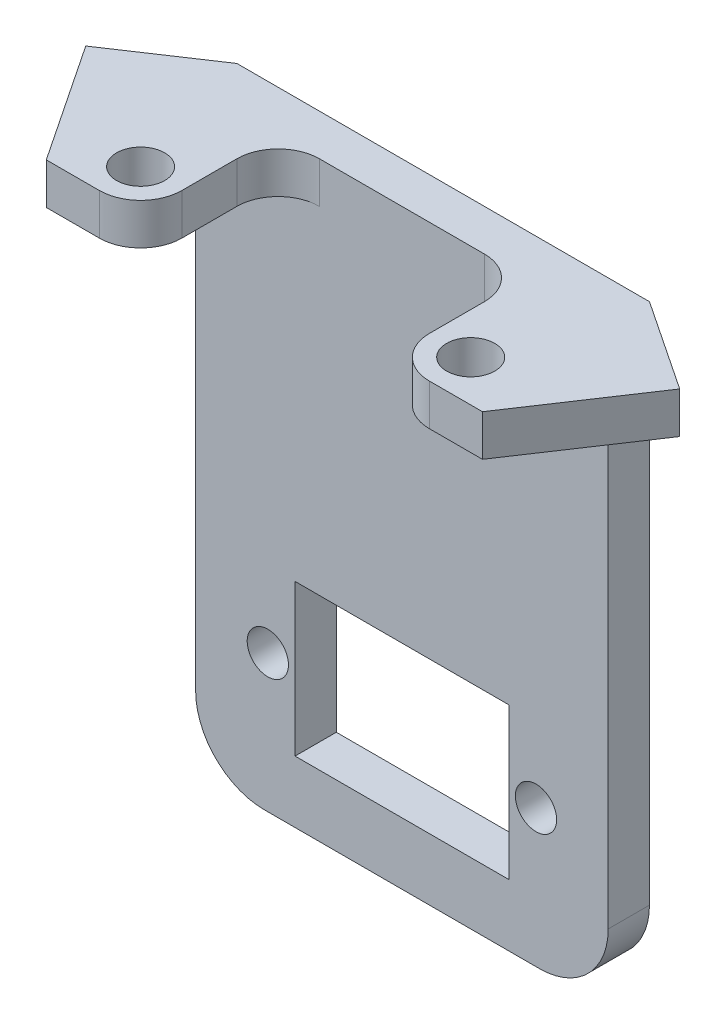
from build123d import *
from build123d.topology import SkipClean

# Parameters (mm, degrees)
SKETCH1_W           = 25
SKETCH1_H           = 20
SKETCH1_R           = 1.5
BOSS_EXTRUDE1_DEPTH = 3
SKETCH2_W           = 15.54
SKETCH2_H           = 11
CUT_EXTRUDE1_DEPTH  = 17.286497475
SKETCH4_W           = 25
SKETCH4_H           = 3
BOSS_EXTRUDE2_DEPTH = 3
SKETCH5_W           = 25
SKETCH5_H           = 3
BOSS_EXTRUDE3_DEPTH = 10
SKETCH11_W          = 25
SKETCH11_H          = 13
BOSS_EXTRUDE5_DEPTH = 20
SKETCH12_W          = 25
SKETCH12_H          = 10
CUT_EXTRUDE4_DEPTH  = 20
BOSS_EXTRUDE6_DEPTH = 2.5
BOSS_EXTRUDE7_DEPTH = 2.5
SKETCH16_R          = 1.75
CUT_EXTRUDE5_DEPTH  = 45.654227124
FILLET6_R           = 3
FILLET7_R           = 3
CUT_EXTRUDE6_DEPTH  = 45.654227124
FILLET8_R           = 5
BOSS_EXTRUDE8_DEPTH = 3


with BuildPart() as part:
    # Sketch1 → Boss-Extrude1 (new body)
    with BuildSketch(Plane.XY):
        Rectangle(SKETCH1_W, SKETCH1_H)
        with Locations((-9.75, 0)):
            Circle(SKETCH1_R, mode=Mode.SUBTRACT)
        with Locations((9.75, 0)):
            Circle(SKETCH1_R, mode=Mode.SUBTRACT)
    extrude(amount=BOSS_EXTRUDE1_DEPTH)

    # Sketch2 → Cut-Extrude1 (cut, through all)
    with BuildSketch(Plane.XY.offset(3)):
        Rectangle(SKETCH2_W, SKETCH2_H)
    extrude(amount=-CUT_EXTRUDE1_DEPTH, mode=Mode.SUBTRACT)

    # Sketch4 → Boss-Extrude2 (add)
    with BuildSketch(Plane(origin=(0, 10, 0), x_dir=(1, 0, 0), z_dir=(0, 1, 0))):
        with Locations((0, -1.5)):
            Rectangle(SKETCH4_W, SKETCH4_H)
    extrude(amount=BOSS_EXTRUDE2_DEPTH)

    # Sketch5 → Boss-Extrude3 (add)
    with BuildSketch(Plane.XY.offset(3)):
        with Locations((0, 11.5)):
            Rectangle(SKETCH5_W, SKETCH5_H)
    extrude(amount=BOSS_EXTRUDE3_DEPTH)

    # Sketch11 → Boss-Extrude5 (add)
    with BuildSketch(Plane(origin=(0, 13, 0), x_dir=(1, 0, 0), z_dir=(0, 1, 0))):
        with Locations((0, -6.5)):
            Rectangle(SKETCH11_W, SKETCH11_H)
    extrude(amount=BOSS_EXTRUDE5_DEPTH)

    # Sketch12 → Cut-Extrude4 (cut)
    with BuildSketch(Plane.XZ.offset(-10)):
        with Locations((0, 8)):
            Rectangle(SKETCH12_W, SKETCH12_H)
    extrude(amount=-CUT_EXTRUDE4_DEPTH, mode=Mode.SUBTRACT)

    # Sketch13 → Boss-Extrude6 (add)
    with BuildSketch(Plane.ZY.offset(12.5)):
        Polygon((3, -10), (3, 30), (13, 30), (13, 33), (0, 33), (0, -10), align=None)
    extrude(amount=BOSS_EXTRUDE6_DEPTH)

    # Sketch14 → Boss-Extrude7 (add)
    with BuildSketch(Plane(origin=(12.5, 0, 0), x_dir=(0, 0, -1), z_dir=(1, 0, 0))):
        Polygon((-13, 30), (-3, 30), (-3, -10), (0, -10), (0, 33), (-13, 33), align=None)
    extrude(amount=BOSS_EXTRUDE7_DEPTH)

    # Sketch16 → Cut-Extrude5 (cut, through all)
    with BuildSketch(Plane.XZ.offset(-30)):
        with Locations(Location((-12, 10, 0), (0, 0, 270))):
            Circle(SKETCH16_R)
        with Locations(Location((12, 10, 0), (0, 0, 270))):
            Circle(SKETCH16_R)
    extrude(amount=-CUT_EXTRUDE5_DEPTH, mode=Mode.SUBTRACT)

    # Fillet6
    fillet6_edges = [part.edges().sort_by_distance(p)[0] for p in [
        (-15, 31.5, 13),
    ]]
    fillet(fillet6_edges, radius=FILLET6_R)

    # Fillet7
    fillet7_edges = [part.edges().sort_by_distance(p)[0] for p in [
        (15, 31.5, 13),
    ]]
    fillet(fillet7_edges, radius=FILLET7_R)

    # Sketch17 → Cut-Extrude6 (cut, through all)
    with SkipClean():  # the faces are left unmerged after this step: merging them gives an invalid solid
        with BuildSketch(Plane.XZ.offset(-30)):
            with BuildLine():
                Line((-9, 10), (-9, 6))
                ThreePointArc((-9, 6), (-8.121320344, 3.878679656), (-6, 3))
                Line((-6, 3), (6, 3))
                ThreePointArc((6, 3), (8.121320344, 3.878679656), (9, 6))
                Line((9, 6), (9, 10))
                ThreePointArc((9, 10), (9.878679656, 12.121320344), (12, 13))
                Line((12, 13), (-12, 13))
                ThreePointArc((-12, 13), (-9.878679656, 12.121320344), (-9, 10))
            make_face()
        extrude(amount=-CUT_EXTRUDE6_DEPTH, mode=Mode.SUBTRACT)

    # Fillet8
    fillet8_edges = [part.edges().sort_by_distance(p)[0] for p in [
        (15, -10, 1.5),
        (-15, -10, 1.5),
    ]]
    fillet(fillet8_edges, radius=FILLET8_R)

    # Sketch18 → Boss-Extrude8 (add)
    with BuildSketch(Plane.XZ.offset(-30)):
        with BuildLine():
            Line((-12, 13), (-15.857475084, 13))
            Line((-15.857475084, 13), (-21.593636596, 4.395757731))
            Line((-21.593636596, 4.395757731), (-15, 0))
            Line((-15, 0), (-15, 10))
            ThreePointArc((-15, 10), (-14.121320344, 12.121320344), (-12, 13))
        make_face()
        with BuildLine():
            Line((12, 13), (15.857475084, 13))
            Line((15.857475084, 13), (21.593636596, 4.395757731))
            Line((21.593636596, 4.395757731), (15, 0))
            Line((15, 0), (15, 10))
            ThreePointArc((15, 10), (14.121320344, 12.121320344), (12, 13))
        make_face()
    extrude(amount=-BOSS_EXTRUDE8_DEPTH)


solid = part.part
